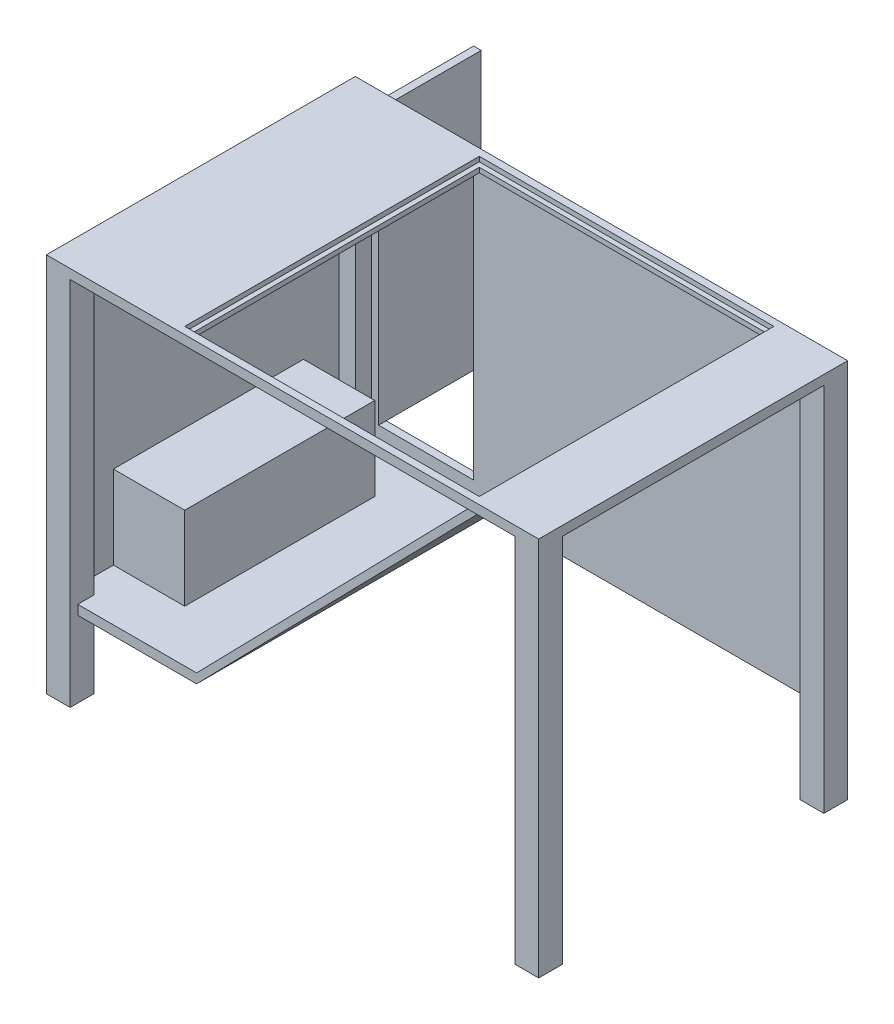
from build123d import *

# Parameters (mm, degrees)
ESQUISSE2_W             = 1036
ESQUISSE2_H             = 650
BOSS_EXTRU_1_DEPTH      = 20
ESQUISSE3_W             = 620
ESQUISSE3_H             = 620
ENL_V_MAT_EXTRU_1_DEPTH = 10
ESQUISSE4_W             = 600
ESQUISSE4_H             = 600
ENL_V_MAT_EXTRU_2_DEPTH = 10
ESQUISSE5_W             = 50
ESQUISSE5_H             = 50
BOSS_EXTRU_2_DEPTH      = 780
ESQUISSE6_W             = 16
ESQUISSE6_H             = 550
BOSS_EXTRU_3_DEPTH      = 620
BOSS_EXTRU_5_DEPTH      = 20
ESQUISSE10_W            = 150
ESQUISSE10_H            = 400
BOSS_EXTRU_6_DEPTH      = 175
ESQUISSE20_R            = 25
ENL_V_MAT_EXTRU_4_DEPTH = 16
ESQUISSE21_W            = 936
ESQUISSE21_H            = 620
BOSS_EXTRU_7_DEPTH      = 16
BOSS_EXTRU_8_DEPTH      = 618
ESQUISSE25_W            = 200
ESQUISSE25_H            = 575
ENL_V_MAT_EXTRU_5_DEPTH = 16
ESQUISSE26_W            = 16
ESQUISSE26_H            = 575
BOSS_EXTRU_9_DEPTH      = 200


with BuildPart() as part:
    # Esquisse2 → Boss.-Extru.1 (new body)
    with BuildSketch(Plane(origin=(0, 0, 0), x_dir=(1, 0, 0), z_dir=(0, 1, 0))):
        with Locations((476.22027439, -276.413871951)):
            Rectangle(ESQUISSE2_W, ESQUISSE2_H)
    extrude(amount=BOSS_EXTRU_1_DEPTH)

    # Esquisse3 → Enlèv. mat.-Extru.1 (cut)
    with BuildSketch(Plane(origin=(0, 20, 0), x_dir=(1, 0, 0), z_dir=(0, 1, 0))):
        with Locations((544.22027439, -276.413871951)):
            Rectangle(ESQUISSE3_W, ESQUISSE3_H)
    extrude(amount=-ENL_V_MAT_EXTRU_1_DEPTH, mode=Mode.SUBTRACT)

    # Esquisse4 → Enlèv. mat.-Extru.2 (cut)
    with BuildSketch(Plane(origin=(0, 10, 0), x_dir=(1, 0, 0), z_dir=(0, 1, 0))):
        with Locations((544.22027439, -276.413871951)):
            Rectangle(ESQUISSE4_W, ESQUISSE4_H)
    extrude(amount=-ENL_V_MAT_EXTRU_2_DEPTH, mode=Mode.SUBTRACT)

    # Esquisse5 → Boss.-Extru.2 (add)
    with BuildSketch(Plane.XZ):
        with Locations((-16.77972561, 576.413871951)):
            Rectangle(ESQUISSE5_W, ESQUISSE5_H)
        with Locations((969.22027439, 576.413871951)):
            Rectangle(ESQUISSE5_W, ESQUISSE5_H)
        with Locations((-16.77972561, -23.586128049)):
            Rectangle(ESQUISSE5_W, ESQUISSE5_H)
        with Locations((969.22027439, -23.586128049)):
            Rectangle(ESQUISSE5_W, ESQUISSE5_H)
    extrude(amount=BOSS_EXTRU_2_DEPTH)

    # Esquisse6 → Boss.-Extru.3 (add)
    with BuildSketch(Plane.XZ):
        with Locations((-33.77972561, 276.413871951)):
            Rectangle(ESQUISSE6_W, ESQUISSE6_H)
    extrude(amount=BOSS_EXTRU_3_DEPTH)

    # Esquisse8 → Boss.-Extru.5 (add)
    with BuildSketch(Plane.XZ.offset(620)):
        Polygon((-25.77972561, 551.413871951), (8.22027439, 551.413871951), (8.22027439, 585.413871951), (258.22027439, 585.413871951), (258.22027439, -32.586128049), (8.22027439, -32.586128049), (8.22027439, 1.413871951), (-25.77972561, 1.413871951), align=None)
    extrude(amount=-BOSS_EXTRU_5_DEPTH)

    # Esquisse10 → Boss.-Extru.6 (add)
    with BuildSketch(Plane(origin=(0, -600, 0), x_dir=(1, 0, 0), z_dir=(0, 1, 0))):
        with Locations((49.22027439, -276.413871951)):
            Rectangle(ESQUISSE10_W, ESQUISSE10_H)
    extrude(amount=BOSS_EXTRU_6_DEPTH)

    # Esquisse20 → Enlèv. mat.-Extru.4 (cut)
    with BuildSketch(Plane.ZY.offset(41.77972561)):
        with Locations((31.413871951, -30)):
            Circle(ESQUISSE20_R)
    extrude(amount=-ENL_V_MAT_EXTRU_4_DEPTH, mode=Mode.SUBTRACT)

    # Esquisse21 → Boss.-Extru.7 (add)
    with BuildSketch(Plane(origin=(0, 0, -32.586128049), x_dir=(-1, 0, 0), z_dir=(0, 0, -1))):
        with Locations((-476.22027439, -310)):
            Rectangle(ESQUISSE21_W, ESQUISSE21_H)
    extrude(amount=BOSS_EXTRU_7_DEPTH)

    # Esquisse24 → Boss.-Extru.8 (add)
    with BuildSketch(Plane.XY.offset(-32.586128049)):
        Polygon((258.22027439, -620), (258.22027439, -600), (844.22027439, 0), (864.22027439, 0), align=None)
    extrude(amount=BOSS_EXTRU_8_DEPTH)

    # Esquisse25 → Enlèv. mat.-Extru.5 (cut)
    with BuildSketch(Plane.XY.offset(-32.586128049)):
        with Locations((123.22027439, -287.5)):
            Rectangle(ESQUISSE25_W, ESQUISSE25_H)
    extrude(amount=-ENL_V_MAT_EXTRU_5_DEPTH, mode=Mode.SUBTRACT)

    # Esquisse26 → Boss.-Extru.9 (add)
    with BuildSketch(Plane(origin=(0, 0, -48.586128049), x_dir=(-1, 0, 0), z_dir=(0, 0, -1))):
        with Locations((-15.22027439, -287.5)):
            Rectangle(ESQUISSE26_W, ESQUISSE26_H)
    extrude(amount=BOSS_EXTRU_9_DEPTH)


solid = part.part
